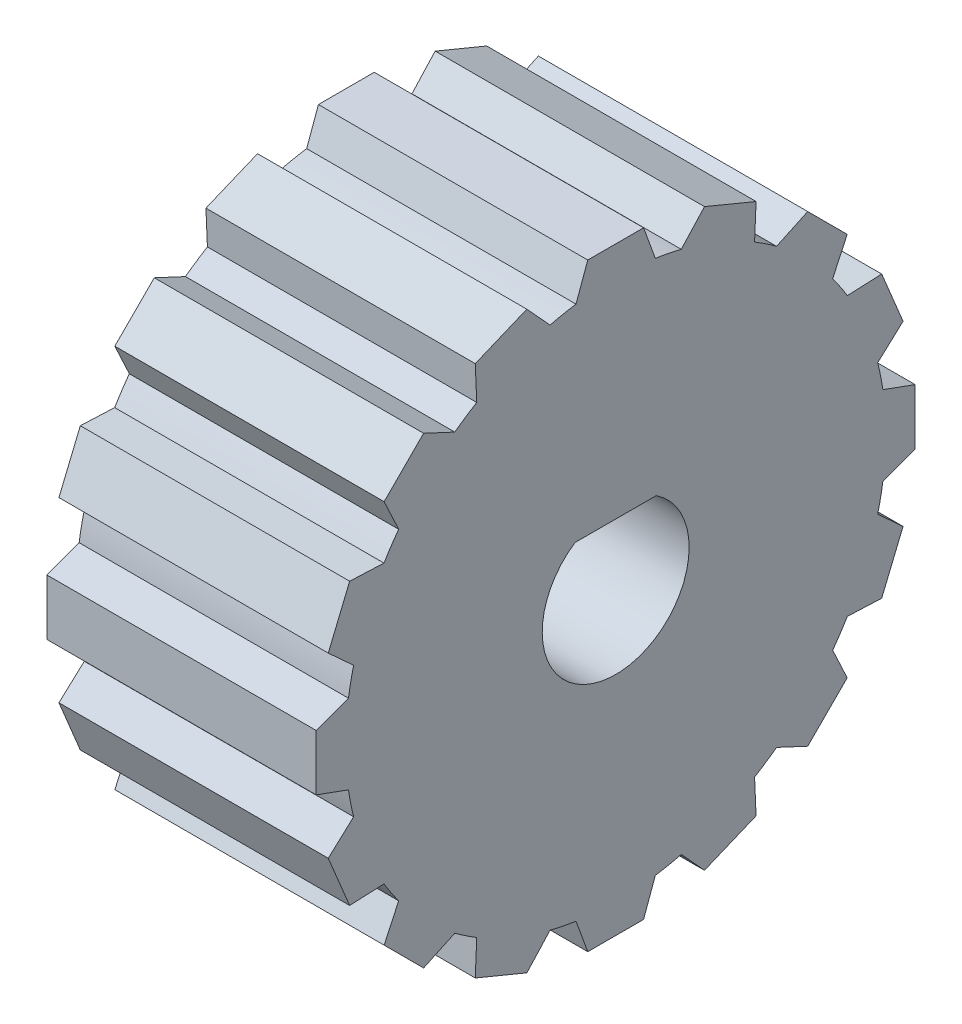
from build123d import *

# Parameters (mm, degrees)
RIB1_REACH         = 26.171
SKETCH5_WALL_W     = 63.342527862
SKETCH5_WALL_H     = 2.28033022
RIB1_DRAFT_ANGLE   = 20
RIB2_REACH         = 26.171
SKETCH6_WALL_W     = 63.342527862
SKETCH6_WALL_H     = 2.28033022
RIB2_DRAFT_ANGLE   = 20
RIB3_REACH         = 26.171
SKETCH7_WALL_W     = 63.342527862
SKETCH7_WALL_H     = 2.28033022
RIB3_DRAFT_ANGLE   = 20
RIB4_REACH         = 26.171
SKETCH8_WALL_W     = 63.342527862
SKETCH8_WALL_H     = 2.28033022
RIB4_DRAFT_ANGLE   = 20
RIB5_REACH         = 26.171
SKETCH9_WALL_W     = 63.342527862
SKETCH9_WALL_H     = 2.28033022
RIB5_DRAFT_ANGLE   = 20
RIB6_REACH         = 26.171
SKETCH10_WALL_W    = 63.342527862
SKETCH10_WALL_H    = 2.28033022
RIB6_DRAFT_ANGLE   = 20
RIB7_REACH         = 26.171
SKETCH11_WALL_W    = 63.342527862
SKETCH11_WALL_H    = 2.28033022
RIB7_DRAFT_ANGLE   = 20
RIB8_REACH         = 26.171
SKETCH12_WALL_W    = 63.342527862
SKETCH12_WALL_H    = 2.28033022
RIB8_DRAFT_ANGLE   = 20
RIB9_REACH         = 26.171
SKETCH13_WALL_W    = 63.342527862
SKETCH13_WALL_H    = 2.28033022
RIB9_DRAFT_ANGLE   = 20
RIB10_REACH        = 26.171
SKETCH14_WALL_W    = 63.342527862
SKETCH14_WALL_H    = 2.28033022
RIB10_DRAFT_ANGLE  = 20
RIB11_REACH        = 26.171
SKETCH15_WALL_W    = 63.342527862
SKETCH15_WALL_H    = 2.28033022
RIB11_DRAFT_ANGLE  = 20
RIB12_REACH        = 26.171
SKETCH16_WALL_W    = 63.342527862
SKETCH16_WALL_H    = 2.28033022
RIB12_DRAFT_ANGLE  = 20
RIB13_REACH        = 26.171
SKETCH17_WALL_W    = 63.342527862
SKETCH17_WALL_H    = 2.28033022
RIB13_DRAFT_ANGLE  = 20
RIB14_REACH        = 26.171
SKETCH18_WALL_W    = 63.342527862
SKETCH18_WALL_H    = 2.28033022
RIB14_DRAFT_ANGLE  = 20
RIB15_REACH        = 26.171
SKETCH19_WALL_W    = 63.342527862
SKETCH19_WALL_H    = 2.28033022
RIB15_DRAFT_ANGLE  = 20
RIB16_REACH        = 26.171
SKETCH20_WALL_W    = 63.342527862
SKETCH20_WALL_H    = 2.28033022
RIB16_DRAFT_ANGLE  = 20
SKETCH22_R         = 1.5
CUT_EXTRUDE3_DEPTH = 28.712812921
SKETCH21_R         = 20.000403523
CUT_EXTRUDE1_DEPTH = 28.147743921
CUT_EXTRUDE2_START = 13
SKETCH21_2_R       = 20.000403523
CUT_EXTRUDE2_DEPTH = 15.147743921
CUT_EXTRUDE4_DEPTH = 22.639385313
SKETCH24_R         = 18.96161632
CUT_EXTRUDE5_DEPTH = 2


with BuildPart() as part:
    # Sketch1 → Revolve1 (revolve)
    with BuildSketch(Plane.XY, mode=Mode.PRIVATE) as revolve1_sk:
        Polygon((-7.5, 12.3), (-7.5, 0), (7.5, 0), (7.5, 12.3), (8.5, 15.5), (7.5, 16), (6.5, 12.3), (6.5, 11.032395447), (-6.5, 11.032395447), (-6.5, 12.3), (-7.5, 16), (-8.5, 15.5), align=None)
    revolve(revolve1_sk.sketch.rotate(Axis((-8.5, 0, 0), (1, 0, 0)), 270), axis=Axis((-8.5, 0, 0), (1, 0, 0)))

    # Sketch5 wall → Rib1 (add, up to next)
    with BuildSketch(Plane(origin=(0, -12.232395447, 0), x_dir=(1, 0, 0), z_dir=(0, 1, 0)), mode=Mode.PRIVATE) as rib1_sk1:
        Rectangle(SKETCH5_WALL_W, SKETCH5_WALL_H)
    rib1_tool1 = extrude(rib1_sk1.sketch, amount=RIB1_REACH, mode=Mode.PRIVATE) - part.part
    add(rib1_tool1.solids().sort_by_distance((0, -12.232395447, 0))[0])

    # Rib1 draft
    rib1_draft_faces = [part.faces().sort_by_distance(p)[0] for p in [
        (0, -11.732395447, -1.14016511),
        (0, -11.732395447, 1.14016511),
    ]]
    draft(rib1_draft_faces, Plane.XZ.offset(12.232395447), RIB1_DRAFT_ANGLE)

    # Sketch6 wall → Rib2 (add, up to next)
    with BuildSketch(Plane.XY.offset(-12.232395447), mode=Mode.PRIVATE) as rib2_sk1:
        Rectangle(SKETCH6_WALL_W, SKETCH6_WALL_H)
    rib2_tool1 = extrude(rib2_sk1.sketch, amount=RIB2_REACH, mode=Mode.PRIVATE) - part.part
    add(rib2_tool1.solids().sort_by_distance((0, 0, -12.232395447))[0])

    # Rib2 draft
    rib2_draft_faces = [part.faces().sort_by_distance(p)[0] for p in [
        (0, 1.14016511, -11.732395447),
        (0, -1.14016511, -11.732395447),
    ]]
    draft(rib2_draft_faces, Plane(origin=(0, 0, -12.232395447), x_dir=(1, 0, 0), z_dir=(0, 0, -1)), RIB2_DRAFT_ANGLE)

    # Sketch7 wall → Rib3 (add, up to next)
    with BuildSketch(Plane.XZ.offset(-12.232395447), mode=Mode.PRIVATE) as rib3_sk1:
        Rectangle(SKETCH7_WALL_W, SKETCH7_WALL_H)
    rib3_tool1 = extrude(rib3_sk1.sketch, amount=RIB3_REACH, mode=Mode.PRIVATE) - part.part
    add(rib3_tool1.solids().sort_by_distance((0, 12.232395447, 0))[0])

    # Rib3 draft
    rib3_draft_faces = [part.faces().sort_by_distance(p)[0] for p in [
        (0, 11.732395447, 1.14016511),
        (0, 11.732395447, -1.14016511),
    ]]
    draft(rib3_draft_faces, Plane(origin=(0, 12.232395447, 0), x_dir=(1, 0, 0), z_dir=(0, 1, 0)), RIB3_DRAFT_ANGLE)

    # Sketch8 wall → Rib4 (add, up to next)
    with BuildSketch(Plane(origin=(0, 0, 12.232395447), x_dir=(1, 0, 0), z_dir=(0, 0, -1)), mode=Mode.PRIVATE) as rib4_sk1:
        Rectangle(SKETCH8_WALL_W, SKETCH8_WALL_H)
    rib4_tool1 = extrude(rib4_sk1.sketch, amount=RIB4_REACH, mode=Mode.PRIVATE) - part.part
    add(rib4_tool1.solids().sort_by_distance((0, 0, 12.232395447))[0])

    # Rib4 draft
    rib4_draft_faces = [part.faces().sort_by_distance(p)[0] for p in [
        (0, -1.14016511, 11.732395447),
        (0, 1.14016511, 11.732395447),
    ]]
    draft(rib4_draft_faces, Plane.XY.offset(12.232395447), RIB4_DRAFT_ANGLE)

    # Sketch9 wall → Rib5 (add, up to next)
    with BuildSketch(Plane(origin=(0, 8.649609771, 8.649609771), x_dir=(1, 0, 0), z_dir=(0, -0.707106781187, -0.707106781187)), mode=Mode.PRIVATE) as rib5_sk1:
        Rectangle(SKETCH9_WALL_W, SKETCH9_WALL_H)
    rib5_tool1 = extrude(rib5_sk1.sketch, amount=RIB5_REACH, mode=Mode.PRIVATE) - part.part
    add(rib5_tool1.solids().sort_by_distance((0, 8.649609771, 8.649609771))[0])

    # Rib5 draft
    rib5_draft_faces = [part.faces().sort_by_distance(p)[0] for p in [
        (0, 7.4898379, 9.102274861),
        (0, 9.102274861, 7.4898379),
    ]]
    draft(rib5_draft_faces, Plane(origin=(0, 8.649609771, 8.649609771), x_dir=(1, 0, 0), z_dir=(0, 0.707106781187, 0.707106781187)), RIB5_DRAFT_ANGLE)

    # Sketch10 wall → Rib6 (add, up to next)
    with BuildSketch(Plane(origin=(0, 11.301259787, 4.681135076), x_dir=(1, 0, 0), z_dir=(0, -0.923879532511, -0.382683432365)), mode=Mode.PRIVATE) as rib6_sk1:
        Rectangle(SKETCH10_WALL_W, SKETCH10_WALL_H)
    rib6_tool1 = extrude(rib6_sk1.sketch, amount=RIB6_REACH, mode=Mode.PRIVATE) - part.part
    add(rib6_tool1.solids().sort_by_distance((0, 11.301259787, 4.681135076))[0])

    # Rib6 draft
    rib6_draft_faces = [part.faces().sort_by_distance(p)[0] for p in [
        (0, 10.402997723, 5.543168569),
        (0, 11.275642318, 3.436418151),
    ]]
    draft(rib6_draft_faces, Plane(origin=(0, 11.301259787, 4.681135076), x_dir=(1, 0, 0), z_dir=(0, 0.923879532511, 0.382683432365)), RIB6_DRAFT_ANGLE)

    # Sketch11 wall → Rib7 (add, up to next)
    with BuildSketch(Plane(origin=(0, 4.681135076, -11.301259787), x_dir=(1, 0, 0), z_dir=(0, -0.382683432365, 0.923879532511)), mode=Mode.PRIVATE) as rib7_sk1:
        Rectangle(SKETCH11_WALL_W, SKETCH11_WALL_H)
    rib7_tool1 = extrude(rib7_sk1.sketch, amount=RIB7_REACH, mode=Mode.PRIVATE) - part.part
    add(rib7_tool1.solids().sort_by_distance((0, 4.681135076, -11.301259787))[0])

    # Rib7 draft
    rib7_draft_faces = [part.faces().sort_by_distance(p)[0] for p in [
        (0, 5.543168569, -10.402997723),
        (0, 3.436418151, -11.275642318),
    ]]
    draft(rib7_draft_faces, Plane(origin=(0, 4.681135076, -11.301259787), x_dir=(1, 0, 0), z_dir=(0, 0.382683432365, -0.923879532511)), RIB7_DRAFT_ANGLE)

    # Sketch12 wall → Rib8 (add, up to next)
    with BuildSketch(Plane(origin=(0, 4.681135076, 11.301259787), x_dir=(1, 0, 0), z_dir=(0, -0.382683432365, -0.923879532511)), mode=Mode.PRIVATE) as rib8_sk1:
        Rectangle(SKETCH12_WALL_W, SKETCH12_WALL_H)
    rib8_tool1 = extrude(rib8_sk1.sketch, amount=RIB8_REACH, mode=Mode.PRIVATE) - part.part
    add(rib8_tool1.solids().sort_by_distance((0, 4.681135076, 11.301259787))[0])

    # Rib8 draft
    rib8_draft_faces = [part.faces().sort_by_distance(p)[0] for p in [
        (0, 3.436418151, 11.275642318),
        (0, 5.543168569, 10.402997723),
    ]]
    draft(rib8_draft_faces, Plane(origin=(0, 4.681135076, 11.301259787), x_dir=(1, 0, 0), z_dir=(0, 0.382683432365, 0.923879532511)), RIB8_DRAFT_ANGLE)

    # Sketch13 wall → Rib9 (add, up to next)
    with BuildSketch(Plane(origin=(0, -8.649609771, 8.649609771), x_dir=(1, 0, 0), z_dir=(0, 0.707106781187, -0.707106781187)), mode=Mode.PRIVATE) as rib9_sk1:
        Rectangle(SKETCH13_WALL_W, SKETCH13_WALL_H)
    rib9_tool1 = extrude(rib9_sk1.sketch, amount=RIB9_REACH, mode=Mode.PRIVATE) - part.part
    add(rib9_tool1.solids().sort_by_distance((0, -8.649609771, 8.649609771))[0])

    # Rib9 draft
    rib9_draft_faces = [part.faces().sort_by_distance(p)[0] for p in [
        (0, -9.102274861, 7.4898379),
        (0, -7.4898379, 9.102274861),
    ]]
    draft(rib9_draft_faces, Plane(origin=(0, -8.649609771, 8.649609771), x_dir=(1, 0, 0), z_dir=(0, -0.707106781187, 0.707106781187)), RIB9_DRAFT_ANGLE)

    # Sketch14 wall → Rib10 (add, up to next)
    with BuildSketch(Plane(origin=(0, 8.649609771, -8.649609771), x_dir=(1, 0, 0), z_dir=(0, -0.707106781187, 0.707106781187)), mode=Mode.PRIVATE) as rib10_sk1:
        Rectangle(SKETCH14_WALL_W, SKETCH14_WALL_H)
    rib10_tool1 = extrude(rib10_sk1.sketch, amount=RIB10_REACH, mode=Mode.PRIVATE) - part.part
    add(rib10_tool1.solids().sort_by_distance((0, 8.649609771, -8.649609771))[0])

    # Rib10 draft
    rib10_draft_faces = [part.faces().sort_by_distance(p)[0] for p in [
        (0, 9.102274861, -7.4898379),
        (0, 7.4898379, -9.102274861),
    ]]
    draft(rib10_draft_faces, Plane(origin=(0, 8.649609771, -8.649609771), x_dir=(1, 0, 0), z_dir=(0, 0.707106781187, -0.707106781187)), RIB10_DRAFT_ANGLE)

    # Sketch15 wall → Rib11 (add, up to next)
    with BuildSketch(Plane(origin=(0, -8.649609771, -8.649609771), x_dir=(1, 0, 0), z_dir=(0, 0.707106781187, 0.707106781187)), mode=Mode.PRIVATE) as rib11_sk1:
        Rectangle(SKETCH15_WALL_W, SKETCH15_WALL_H)
    rib11_tool1 = extrude(rib11_sk1.sketch, amount=RIB11_REACH, mode=Mode.PRIVATE) - part.part
    add(rib11_tool1.solids().sort_by_distance((0, -8.649609771, -8.649609771))[0])

    # Rib11 draft
    rib11_draft_faces = [part.faces().sort_by_distance(p)[0] for p in [
        (0, -7.4898379, -9.102274861),
        (0, -9.102274861, -7.4898379),
    ]]
    draft(rib11_draft_faces, Plane(origin=(0, -8.649609771, -8.649609771), x_dir=(1, 0, 0), z_dir=(0, -0.707106781187, -0.707106781187)), RIB11_DRAFT_ANGLE)

    # Sketch16 wall → Rib12 (add, up to next)
    with BuildSketch(Plane(origin=(0, 11.301259787, -4.681135076), x_dir=(1, 0, 0), z_dir=(0, -0.923879532511, 0.382683432365)), mode=Mode.PRIVATE) as rib12_sk1:
        Rectangle(SKETCH16_WALL_W, SKETCH16_WALL_H)
    rib12_tool1 = extrude(rib12_sk1.sketch, amount=RIB12_REACH, mode=Mode.PRIVATE) - part.part
    add(rib12_tool1.solids().sort_by_distance((0, 11.301259787, -4.681135076))[0])

    # Rib12 draft
    rib12_draft_faces = [part.faces().sort_by_distance(p)[0] for p in [
        (0, 11.275642318, -3.436418151),
        (0, 10.402997723, -5.543168569),
    ]]
    draft(rib12_draft_faces, Plane(origin=(0, 11.301259787, -4.681135076), x_dir=(1, 0, 0), z_dir=(0, 0.923879532511, -0.382683432365)), RIB12_DRAFT_ANGLE)

    # Sketch17 wall → Rib13 (add, up to next)
    with BuildSketch(Plane(origin=(0, -11.301259787, -4.681135076), x_dir=(1, 0, 0), z_dir=(0, 0.923879532511, 0.382683432365)), mode=Mode.PRIVATE) as rib13_sk1:
        Rectangle(SKETCH17_WALL_W, SKETCH17_WALL_H)
    rib13_tool1 = extrude(rib13_sk1.sketch, amount=RIB13_REACH, mode=Mode.PRIVATE) - part.part
    add(rib13_tool1.solids().sort_by_distance((0, -11.301259787, -4.681135076))[0])

    # Rib13 draft
    rib13_draft_faces = [part.faces().sort_by_distance(p)[0] for p in [
        (0, -10.402997723, -5.543168569),
        (0, -11.275642318, -3.436418151),
    ]]
    draft(rib13_draft_faces, Plane(origin=(0, -11.301259787, -4.681135076), x_dir=(1, 0, 0), z_dir=(0, -0.923879532511, -0.382683432365)), RIB13_DRAFT_ANGLE)

    # Sketch18 wall → Rib14 (add, up to next)
    with BuildSketch(Plane(origin=(0, -4.681135076, 11.301259787), x_dir=(1, 0, 0), z_dir=(0, 0.382683432365, -0.923879532511)), mode=Mode.PRIVATE) as rib14_sk1:
        Rectangle(SKETCH18_WALL_W, SKETCH18_WALL_H)
    rib14_tool1 = extrude(rib14_sk1.sketch, amount=RIB14_REACH, mode=Mode.PRIVATE) - part.part
    add(rib14_tool1.solids().sort_by_distance((0, -4.681135076, 11.301259787))[0])

    # Rib14 draft
    rib14_draft_faces = [part.faces().sort_by_distance(p)[0] for p in [
        (0, -5.543168569, 10.402997723),
        (0, -3.436418151, 11.275642318),
    ]]
    draft(rib14_draft_faces, Plane(origin=(0, -4.681135076, 11.301259787), x_dir=(1, 0, 0), z_dir=(0, -0.382683432365, 0.923879532511)), RIB14_DRAFT_ANGLE)

    # Sketch19 wall → Rib15 (add, up to next)
    with BuildSketch(Plane(origin=(0, -4.681135076, -11.301259787), x_dir=(1, 0, 0), z_dir=(0, 0.382683432365, 0.923879532511)), mode=Mode.PRIVATE) as rib15_sk1:
        Rectangle(SKETCH19_WALL_W, SKETCH19_WALL_H)
    rib15_tool1 = extrude(rib15_sk1.sketch, amount=RIB15_REACH, mode=Mode.PRIVATE) - part.part
    add(rib15_tool1.solids().sort_by_distance((0, -4.681135076, -11.301259787))[0])

    # Rib15 draft
    rib15_draft_faces = [part.faces().sort_by_distance(p)[0] for p in [
        (0, -3.436418151, -11.275642318),
        (0, -5.543168569, -10.402997723),
    ]]
    draft(rib15_draft_faces, Plane(origin=(0, -4.681135076, -11.301259787), x_dir=(1, 0, 0), z_dir=(0, -0.382683432365, -0.923879532511)), RIB15_DRAFT_ANGLE)

    # Sketch20 wall → Rib16 (add, up to next)
    with BuildSketch(Plane(origin=(0, -11.301259787, 4.681135076), x_dir=(1, 0, 0), z_dir=(0, 0.923879532511, -0.382683432365)), mode=Mode.PRIVATE) as rib16_sk1:
        Rectangle(SKETCH20_WALL_W, SKETCH20_WALL_H)
    rib16_tool1 = extrude(rib16_sk1.sketch, amount=RIB16_REACH, mode=Mode.PRIVATE) - part.part
    add(rib16_tool1.solids().sort_by_distance((0, -11.301259787, 4.681135076))[0])

    # Rib16 draft
    rib16_draft_faces = [part.faces().sort_by_distance(p)[0] for p in [
        (0, -11.275642318, 3.436418151),
        (0, -10.402997723, 5.543168569),
    ]]
    draft(rib16_draft_faces, Plane(origin=(0, -11.301259787, 4.681135076), x_dir=(1, 0, 0), z_dir=(0, -0.923879532511, 0.382683432365)), RIB16_DRAFT_ANGLE)

    # Sketch22 → Cut-Extrude3 (cut, through all)
    with BuildSketch(Plane(origin=(7.5, 0, 0), x_dir=(0, 0, -1), z_dir=(1, 0, 0))):
        Circle(SKETCH22_R)
    extrude(amount=-CUT_EXTRUDE3_DEPTH, mode=Mode.SUBTRACT)

    # Sketch21 → Cut-Extrude1 (cut, through all)
    with BuildSketch(Plane(origin=(-6.5, 0, 0), x_dir=(0, 0, -1), z_dir=(1, 0, 0))):
        Circle(SKETCH21_R)
    extrude(amount=-CUT_EXTRUDE1_DEPTH, mode=Mode.SUBTRACT)

    # Sketch21<2> → Cut-Extrude2 (cut, through all)
    with BuildSketch(Plane(origin=(-6.5, 0, 0), x_dir=(0, 0, -1), z_dir=(1, 0, 0)).offset(CUT_EXTRUDE2_START)):
        Circle(SKETCH21_2_R)
    extrude(amount=CUT_EXTRUDE2_DEPTH, mode=Mode.SUBTRACT)

    # Sketch23 → Cut-Extrude4 (cut, through all)
    with BuildSketch(Plane(origin=(6.5, 0, 0), x_dir=(0, 0, -1), z_dir=(1, 0, 0))):
        with BuildLine():
            Line((-1.658312395, 2.5), (1.658312395, 2.5))
            ThreePointArc((1.658312395, 2.5), (0, -3), (-1.658312395, 2.5))
        make_face()
    extrude(amount=-CUT_EXTRUDE4_DEPTH, mode=Mode.SUBTRACT)

    # Sketch24 → Cut-Extrude5 (cut)
    with BuildSketch(Plane(origin=(6.5, 0, 0), x_dir=(0, 0, -1), z_dir=(1, 0, 0))):
        Circle(SKETCH24_R)
    extrude(amount=-CUT_EXTRUDE5_DEPTH, mode=Mode.SUBTRACT)


solid = part.part
